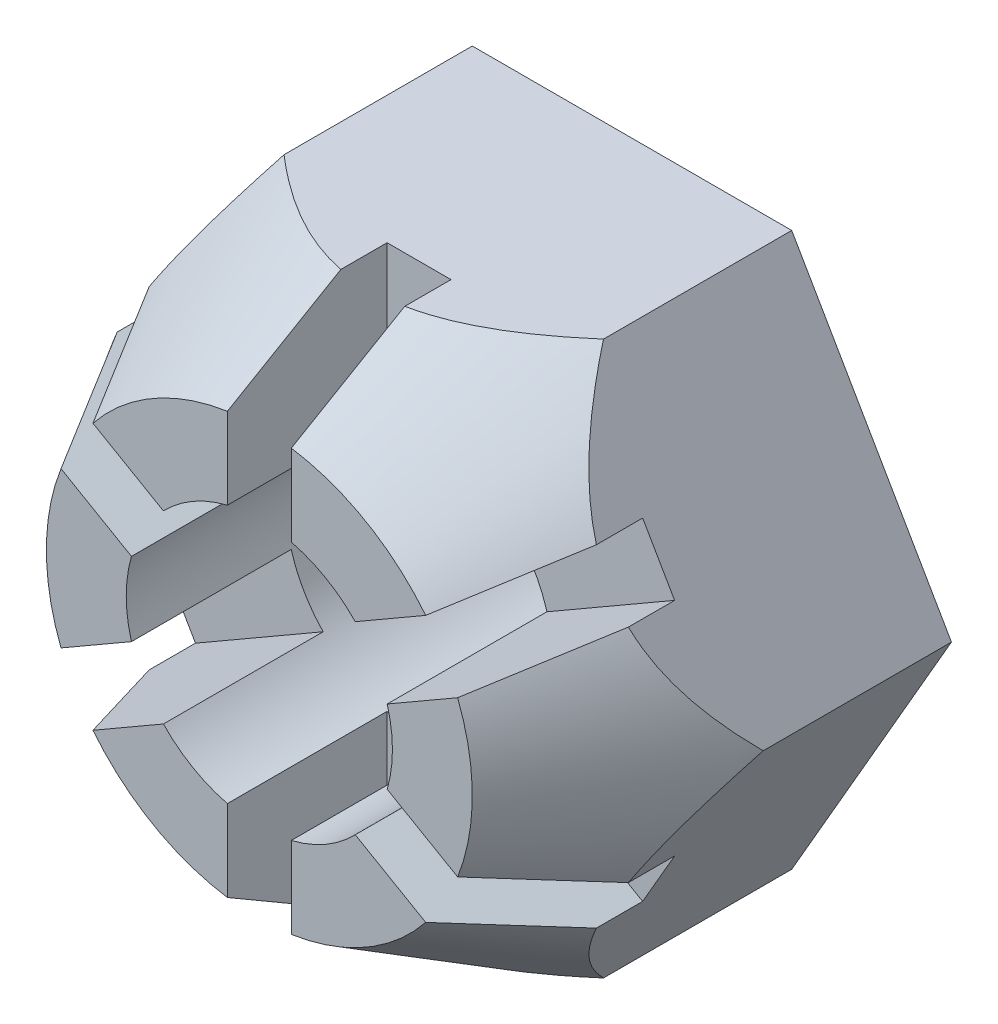
from build123d import *

# Parameters (mm, degrees)
BOSS_EXTRUDE1_DEPTH = 70
SKETCH2_R           = 25
CUT_EXTRUDE1_DEPTH  = 106.830052443
SKETCH3_OUTSIDE_W   = 237.528
SKETCH3_OUTSIDE_H   = 221.452
SKETCH3_OUTSIDE_R   = 40
CUT_EXTRUDE2_DEPTH  = 70
CUT_EXTRUDE2_DRAFT  = -30
SKETCH6_W           = 12
SKETCH6_H           = 28.841258608
CUT_EXTRUDE3_DEPTH  = 30
CIRPATTERN1_COUNT   = 6


with BuildPart() as part:
    # Sketch1 → Boss-Extrude1 (new body)
    with BuildSketch(Plane.XY):
        Polygon((60, 0), (30, 51.961524227), (-30, 51.961524227), (-60, 0), (-30, -51.961524227), (30, -51.961524227), align=None)
    extrude(amount=BOSS_EXTRUDE1_DEPTH)

    # Sketch2 → Cut-Extrude1 (cut, through all)
    with BuildSketch(Plane.XY.offset(70)):
        Circle(SKETCH2_R)
    extrude(amount=-CUT_EXTRUDE1_DEPTH, mode=Mode.SUBTRACT)


with BuildPart() as cut_extrude2_tool:
    # Sketch3 outside → Cut-Extrude2 (with draft: the straight prism first)
    with BuildSketch(Plane.XY.offset(70)):
        Rectangle(SKETCH3_OUTSIDE_W, SKETCH3_OUTSIDE_H)
        Circle(SKETCH3_OUTSIDE_R, mode=Mode.SUBTRACT)
    extrude(amount=-CUT_EXTRUDE2_DEPTH)
    # Cut-Extrude2: the draft: its side faces are tilted about the plane it starts from
    cut_extrude2_sides = [cut_extrude2_tool.faces().sort_by_distance(p)[0] for p in [
        (0, -110.726, 35),
        (118.764, 0, 35),
        (0, 110.726, 35),
        (-118.764, 0, 35),
        (-40, 0, 35),
    ]]
    draft(cut_extrude2_sides, Plane.XY.offset(70), CUT_EXTRUDE2_DRAFT)


with BuildPart() as part_1:
    add(part.part)

    # Cut-Extrude2: cut by cut_extrude2_tool
    add(cut_extrude2_tool.part, mode=Mode.SUBTRACT)

    # Sketch6 → Cut-Extrude3 (cut)
    with BuildSketch(Plane.XY.offset(70)):
        with Locations((0, -38.689951503)):
            Rectangle(SKETCH6_W, SKETCH6_H)
    cut_extrude3 = extrude(amount=-CUT_EXTRUDE3_DEPTH, mode=Mode.SUBTRACT)

    # CirPattern1: Cut-Extrude3 ×6 about axis
    cirpattern1_axis = Axis((0, 0, 0), (0, 0, 1))
    for i in range(1, CIRPATTERN1_COUNT):
        add(cut_extrude3.rotate(cirpattern1_axis, i * 360 / CIRPATTERN1_COUNT), mode=Mode.SUBTRACT)


solid = part_1.part
